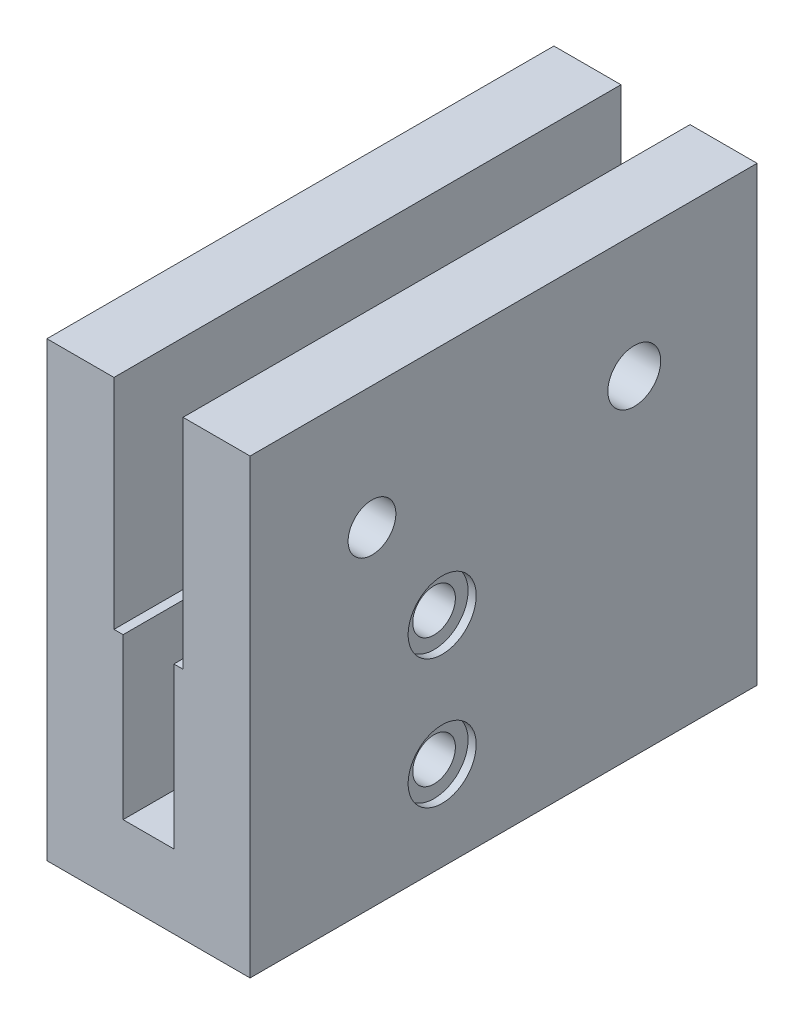
from build123d import *

# Parameters (mm, degrees)
SKETCH2_W               = 20
SKETCH2_H               = 49.91
BOSS_EXTRUDE1_DEPTH     = 44.5
CUT_EXTRUDE3_DEPTH      = 68.611079713
CUT_EXTRUDE5_DEPTH      = 55.799653512
CUT_EXTRUDE5_DEPTH_BACK = 55.799653512
SKETCH8_R               = 2.6
SKETCH8_R_2             = 2.35
SKETCH9_R               = 2.1
CUT_EXTRUDE6_DEPTH      = 6.6
SKETCH9_3_R             = 3.35
SKETCH9_3_R_2           = 2.1
CUT_EXTRUDE7_DEPTH      = 0.8
CUT_EXTRUDE8_START      = -0.8
SKETCH11_R              = 3.35
SKETCH11_R_2            = 2.1
CUT_EXTRUDE8_DEPTH      = 0.8
SKETCH12_W              = 6.8
SKETCH12_H              = 15.77
CUT_EXTRUDE9_DEPTH      = 15


with BuildPart() as part:
    # Sketch2 → Boss-Extrude1 (new body)
    with BuildSketch(Plane(origin=(0, 0, 0), x_dir=(1, 0, 0), z_dir=(0, 1, 0))):
        Rectangle(SKETCH2_W, SKETCH2_H)
    extrude(amount=BOSS_EXTRUDE1_DEPTH)

    # Sketch3 → Cut-Extrude3 (cut, through all)
    with BuildSketch(Plane.XY.offset(24.955)):
        Polygon((3.4, 23.020172412), (3.4, 44.5), (-3.4, 44.5), (-3.4, 23.020172412), (-2.5, 23.020172412), (-2.5, 7.250172412), (2.5, 7.250172412), (2.5, 23.020172412), align=None)
    extrude(amount=-CUT_EXTRUDE3_DEPTH, mode=Mode.SUBTRACT)

    # Sketch8 → Cut-Extrude5 (cut, two sides: drawn at the far end of the back side and taken through both)
    with BuildSketch(Plane.ZY.offset(10).offset(-CUT_EXTRUDE5_DEPTH_BACK)):
        with Locations((-12.865, 32.41)):
            Circle(SKETCH8_R)
        with Locations((12.955, 32.41)):
            Circle(SKETCH8_R_2)
    extrude(amount=CUT_EXTRUDE5_DEPTH + CUT_EXTRUDE5_DEPTH_BACK, mode=Mode.SUBTRACT)

    # Sketch9 → Cut-Extrude6 (cut)
    with BuildSketch(Plane(origin=(10, 0, 0), x_dir=(0, 0, -1), z_dir=(1, 0, 0))):
        with Locations((-6.045, 21.485172412)):
            Circle(SKETCH9_R)
        with Locations((-6.045, 8.785172412)):
            Circle(SKETCH9_R)
    extrude(amount=-CUT_EXTRUDE6_DEPTH, mode=Mode.SUBTRACT)

    # Sketch9<3> → Cut-Extrude7 (cut)
    # profile 1 of 2: a face of its own
    with BuildSketch(Plane(origin=(10, 0, 0), x_dir=(0, 0, -1), z_dir=(1, 0, 0))):
        with Locations((-6.045, 21.485172412)):
            Circle(SKETCH9_3_R)
        with Locations((-6.045, 21.485172412)):
            Circle(SKETCH9_3_R_2, mode=Mode.SUBTRACT)
    # profile 2 of 2: a face of its own
    with BuildSketch(Plane(origin=(10, 0, 0), x_dir=(0, 0, -1), z_dir=(1, 0, 0))):
        with Locations((-6.045, 8.785172412)):
            Circle(SKETCH9_3_R)
        with Locations((-6.045, 8.785172412)):
            Circle(SKETCH9_3_R_2, mode=Mode.SUBTRACT)
    extrude(amount=-CUT_EXTRUDE7_DEPTH, mode=Mode.SUBTRACT)

    # Sketch11 → Cut-Extrude8 (cut)
    # profile 1 of 2: a face of its own
    with BuildSketch(Plane.ZY.offset(-3.4).offset(CUT_EXTRUDE8_START)):
        with Locations((6.045, 21.485172412)):
            Circle(SKETCH11_R)
    # profile 2 of 2: a face of its own
    with BuildSketch(Plane.ZY.offset(-3.4).offset(CUT_EXTRUDE8_START)):
        with Locations((6.045, 8.785172412)):
            Circle(SKETCH11_R)
        with Locations((6.045, 8.785172412)):
            Circle(SKETCH11_R_2, mode=Mode.SUBTRACT)
    extrude(amount=CUT_EXTRUDE8_DEPTH, mode=Mode.SUBTRACT)

    # Sketch12 → Cut-Extrude9 (cut)
    with BuildSketch(Plane(origin=(0, 0, -24.955), x_dir=(-1, 0, 0), z_dir=(0, 0, -1))):
        with Locations((0, 15.135172412)):
            Rectangle(SKETCH12_W, SKETCH12_H)
    extrude(amount=-CUT_EXTRUDE9_DEPTH, mode=Mode.SUBTRACT)


solid = part.part
